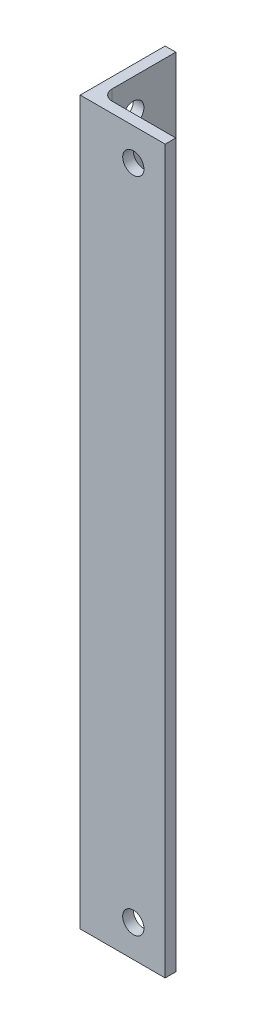
from build123d import *

# Parameters (mm, degrees)
BOSS_EXTRUDE1_DEPTH = 215.9
FILLET1_R           = 3.175
SKETCH2_R           = 3.175
CUT_EXTRUDE1_DEPTH  = 219.522128456
SKETCH3_R           = 3.175
CUT_EXTRUDE2_DEPTH  = 219.522128456
SKETCH4_R           = 3.175
CUT_EXTRUDE3_DEPTH  = 219.522128456
SKETCH5_R           = 3.175
CUT_EXTRUDE4_DEPTH  = 219.522128456


with BuildPart() as part:
    # Sketch1 → Boss-Extrude1 (new body)
    with BuildSketch(Plane(origin=(0, 0, 0), x_dir=(1, 0, 0), z_dir=(0, 1, 0))):
        Polygon((0, 0), (0, -25.4), (25.4, -25.4), (25.4, -22.225), (3.175, -22.225), (3.175, 0), align=None)
    extrude(amount=BOSS_EXTRUDE1_DEPTH)

    # Fillet1
    fillet1_edges = [part.edges().sort_by_distance(p)[0] for p in [
        (3.175, 107.95, 22.225),
    ]]
    fillet(fillet1_edges, radius=FILLET1_R)

    # Sketch2 → Cut-Extrude1 (cut, through all)
    with BuildSketch(Plane(origin=(0, 0, 22.225), x_dir=(-1, 0, 0), z_dir=(0, 0, -1))):
        with Locations((-15.875, 206.248)):
            Circle(SKETCH2_R)
    extrude(amount=-CUT_EXTRUDE1_DEPTH, mode=Mode.SUBTRACT)

    # Sketch3 → Cut-Extrude2 (cut, through all)
    with BuildSketch(Plane(origin=(0, 0, 22.225), x_dir=(-1, 0, 0), z_dir=(0, 0, -1))):
        with Locations((-15.875, 9.652)):
            Circle(SKETCH3_R)
    extrude(amount=-CUT_EXTRUDE2_DEPTH, mode=Mode.SUBTRACT)

    # Sketch4 → Cut-Extrude3 (cut, through all)
    with BuildSketch(Plane(origin=(3.175, 0, 0), x_dir=(0, 0, -1), z_dir=(1, 0, 0))):
        with Locations((-12.7, 206.375)):
            Circle(SKETCH4_R)
    extrude(amount=-CUT_EXTRUDE3_DEPTH, mode=Mode.SUBTRACT)

    # Sketch5 → Cut-Extrude4 (cut, through all)
    with BuildSketch(Plane(origin=(3.175, 0, 0), x_dir=(0, 0, -1), z_dir=(1, 0, 0))):
        with Locations((-12.7, 9.525)):
            Circle(SKETCH5_R)
    extrude(amount=-CUT_EXTRUDE4_DEPTH, mode=Mode.SUBTRACT)


solid = part.part
